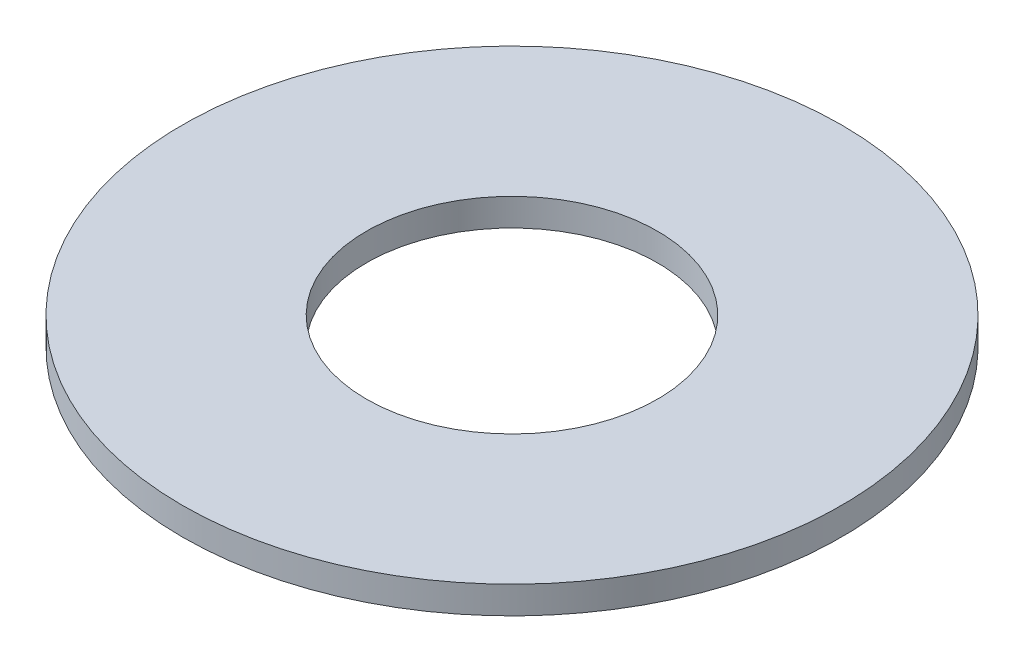
from build123d import *

# Parameters (mm, degrees)
SKETCH1_R           = 6
SKETCH1_R_2         = 2.65
BOSS_EXTRUDE1_DEPTH = 0.5


with BuildPart() as part:
    # Sketch1 → Boss-Extrude1 (new body)
    with BuildSketch(Plane(origin=(0, 0, 0), x_dir=(1, 0, 0), z_dir=(0, 1, 0))):
        with Locations(Location((0, 0, 0), (0, 0, 270))):
            Circle(SKETCH1_R)
        with Locations(Location((0, 0, 0), (0, 0, 270))):
            Circle(SKETCH1_R_2, mode=Mode.SUBTRACT)
    extrude(amount=BOSS_EXTRUDE1_DEPTH)


solid = part.part
